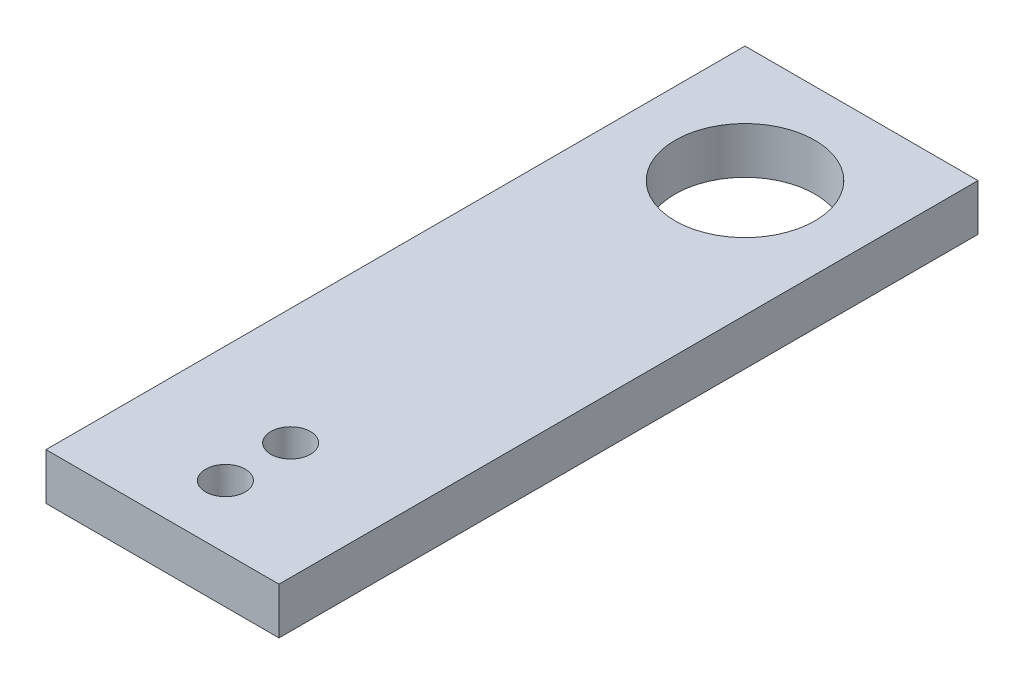
from build123d import *

# Parameters (mm, degrees)
SKETCH1_W           = 50
SKETCH1_H           = 150
SKETCH1_R           = 15
BOSS_EXTRUDE1_DEPTH = 10
SKETCH2_R           = 4.25
CUT_EXTRUDE1_DEPTH  = 10


with BuildPart() as part:
    # Sketch1 → Boss-Extrude1 (new body)
    with BuildSketch(Plane(origin=(0, 0, 0), x_dir=(1, 0, 0), z_dir=(0, 1, 0))):
        with Locations((0, -50)):
            Rectangle(SKETCH1_W, SKETCH1_H)
        with Locations(Location((0, 0, 0), (0, 0, 270))):
            Circle(SKETCH1_R, mode=Mode.SUBTRACT)
    extrude(amount=BOSS_EXTRUDE1_DEPTH)

    # Sketch2 → Cut-Extrude1 (cut)
    with BuildSketch(Plane(origin=(0, 0, 0), x_dir=(1, 0, 0), z_dir=(0, 1, 0))):
        with Locations(Location((0, -111.5, 0), (0, 0, 270))):
            Circle(SKETCH2_R)
        with Locations(Location((0, -97.5, 0), (0, 0, 270))):
            Circle(SKETCH2_R)
    extrude(amount=CUT_EXTRUDE1_DEPTH, mode=Mode.SUBTRACT)


solid = part.part
